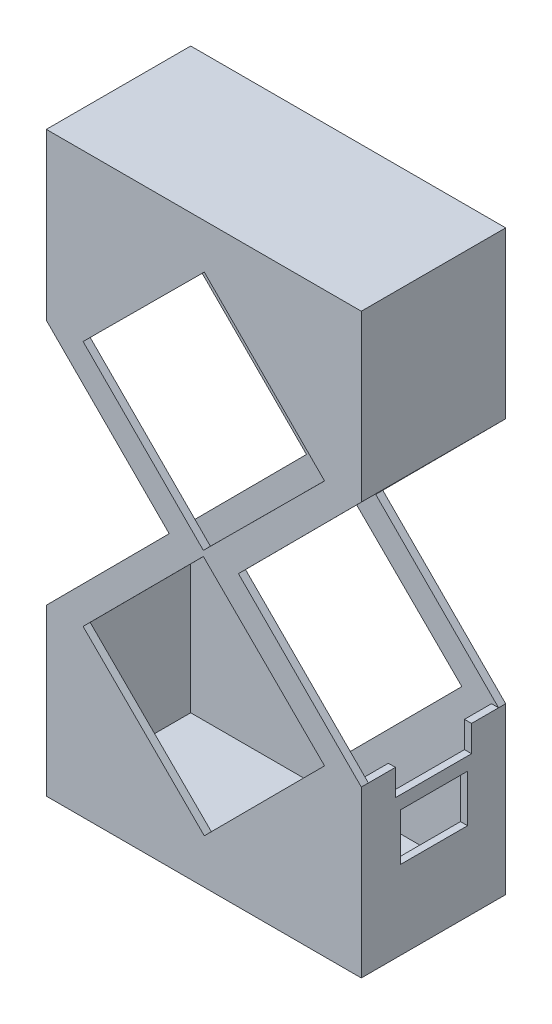
from build123d import *

# Parameters (mm, degrees)
EXTRUDE_1_DEPTH     = 55
EXTRUDE_2_DEPTH     = 55
EXTRUDE_3_DEPTH     = 2.7
EXTRUDE_START       = 52.3
EXTRUDE_4_DEPTH     = 2.7
SKETCH_4_W          = 25.5
SKETCH_4_H          = 18
SKETCH_4_W_2        = 29
SKETCH_4_H_2        = 10
CUT_EXTRUDE_1_DEPTH = 2.7


with BuildPart() as part:
    # 草图2 → 凸台-拉伸1 (new body)
    with BuildSketch(Plane.XY.offset(-27.5)):
        Polygon((57.3, 157), (60, 157), (60, 220), (-60, 220), (-60, 157), (-57.3, 157), (-57.3, 217.3), (57.3, 217.3), align=None)
    extrude(amount=EXTRUDE_1_DEPTH)



with BuildPart() as body_2:
    # 草图2<7> → 凸台-拉伸2 (new body)
    with BuildSketch(Plane.XY.offset(-27.5)):
        Polygon((-60, 0), (60, 0), (60, 63), (57.3, 63), (57.3, 2.7), (-57.3, 2.7), (-57.3, 63), (-60, 63), align=None)
    extrude(amount=EXTRUDE_2_DEPTH)


with BuildPart() as part_1:
    add(part.part)

    add(body_2.part)  # 凸台-拉伸3 merges body 2
    # 草图2<8> → 凸台-拉伸3 (add)
    with BuildSketch(Plane.XY.offset(-27.5)):
        Polygon((57.3, 63), (60, 63), (13.185508624, 110), (60, 157), (57.3, 157), (57.3, 217.3), (-57.3, 217.3), (-57.3, 157), (-60, 157), (-13.185508624, 110), (-60, 63), (-57.3, 63), (-57.3, 2.7), (57.3, 2.7), align=None)
        Polygon((46, 63), (0.18191994, 17.000359728), (-46, 63), (-0.18191994, 108.999640272), align=None, mode=Mode.SUBTRACT)
        Polygon((0.18191994, 202.999640272), (46, 157), (-0.18191994, 111.000359728), (-46, 157), align=None, mode=Mode.SUBTRACT)
    extrude(amount=EXTRUDE_3_DEPTH)

    # 草图2<9> → 凸台-拉伸4 (add)
    with BuildSketch(Plane.XY.offset(-27.5).offset(EXTRUDE_START)):
        Polygon((57.3, 63), (60, 63), (13.185508624, 110), (60, 157), (57.3, 157), (57.3, 217.3), (-57.3, 217.3), (-57.3, 157), (-60, 157), (-13.185508624, 110), (-60, 63), (-57.3, 63), (-57.3, 2.7), (57.3, 2.7), align=None)
        Polygon((46, 63), (0.18191994, 17.000359728), (-46, 63), (-0.18191994, 108.999640272), align=None, mode=Mode.SUBTRACT)
        Polygon((0.18191994, 202.999640272), (46, 157), (-0.18191994, 111.000359728), (-46, 157), align=None, mode=Mode.SUBTRACT)
    extrude(amount=EXTRUDE_4_DEPTH)

    # 草图4 → 切除-拉伸1 (cut)
    with BuildSketch(Plane(origin=(60, 0, 0), x_dir=(0, 0, -1), z_dir=(1, 0, 0))):
        with Locations((0.25, 39)):
            Rectangle(SKETCH_4_W, SKETCH_4_H)
        with Locations((0, 58)):
            Rectangle(SKETCH_4_W_2, SKETCH_4_H_2)
    extrude(amount=-CUT_EXTRUDE_1_DEPTH, mode=Mode.SUBTRACT)


solid = part_1.part
